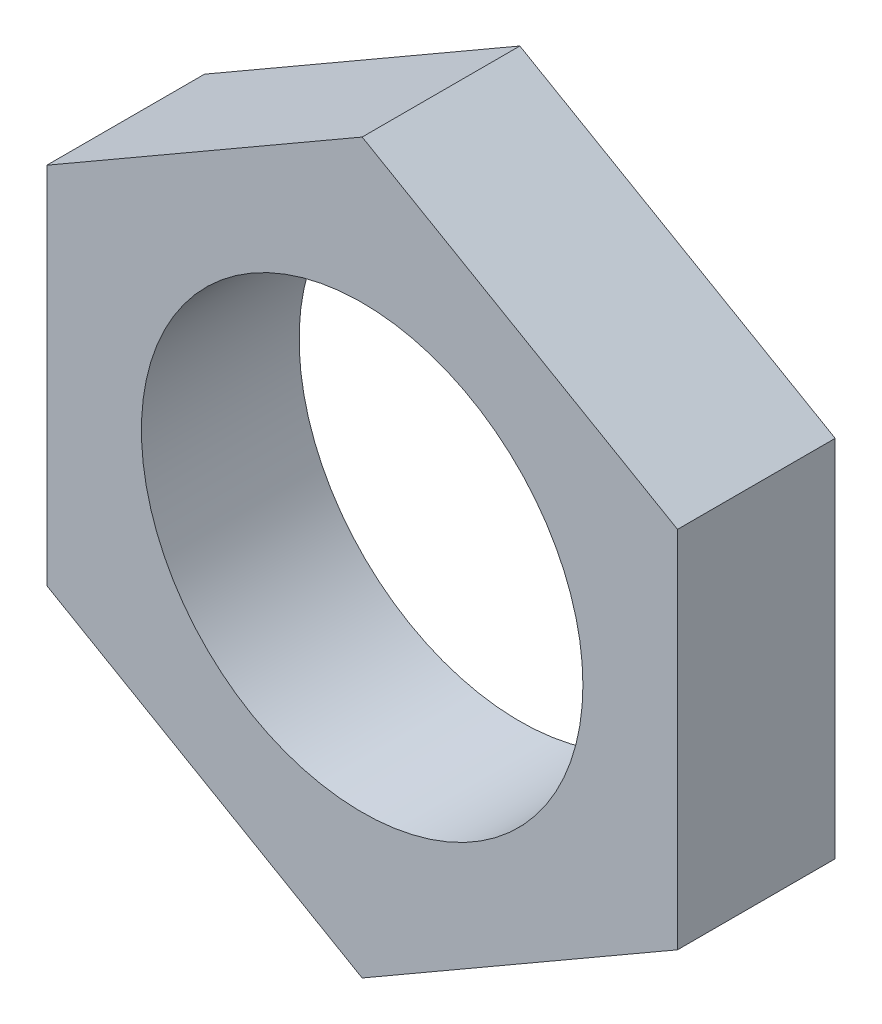
from build123d import *

# Parameters (mm, degrees)
SKETCH_1_R      = 2.8
EXTRUDE_1_DEPTH = 2


with BuildPart() as part:
    # Эскиз1 → Вытянуть1 (new body)
    with BuildSketch(Plane.XY):
        Polygon((0, 4.618802154), (-4, 2.309401077), (-4, -2.309401077), (0, -4.618802154), (4, -2.309401077), (4, 2.309401077), align=None)
        Circle(SKETCH_1_R, mode=Mode.SUBTRACT)
    extrude(amount=EXTRUDE_1_DEPTH)


solid = part.part
